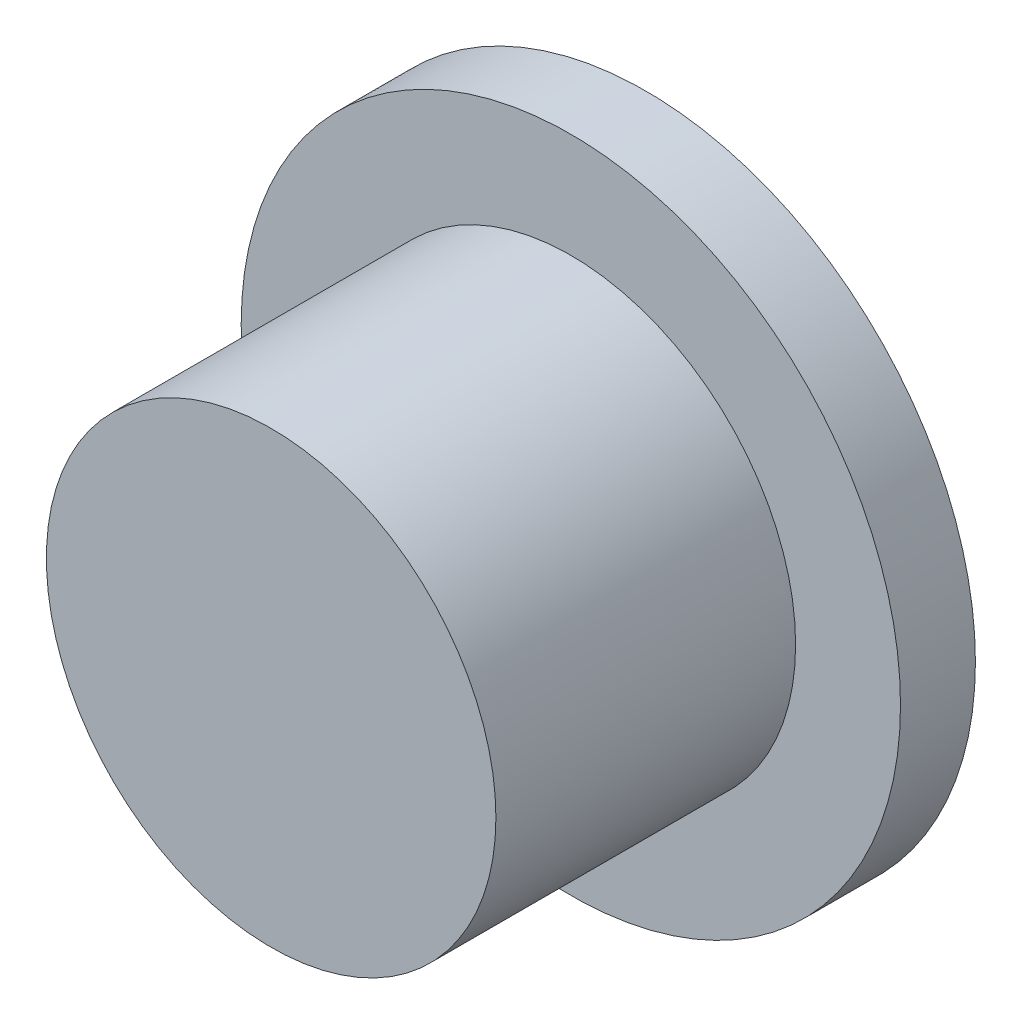
from build123d import *

# Parameters (mm, degrees)
ESQUISSE1_R        = 15
BOSS_EXTRU_1_DEPTH = 20
ESQUISSE2_R        = 22
BOSS_EXTRU_2_DEPTH = 5


with BuildPart() as part:
    # Esquisse1 → Boss.-Extru.1 (new body)
    with BuildSketch(Plane.XY):
        Circle(ESQUISSE1_R)
    extrude(amount=BOSS_EXTRU_1_DEPTH)

    # Esquisse2 → Boss.-Extru.2 (add)
    with BuildSketch(Plane(origin=(0, 0, 0), x_dir=(-1, 0, 0), z_dir=(0, 0, -1))):
        Circle(ESQUISSE2_R)
    extrude(amount=BOSS_EXTRU_2_DEPTH)


solid = part.part
